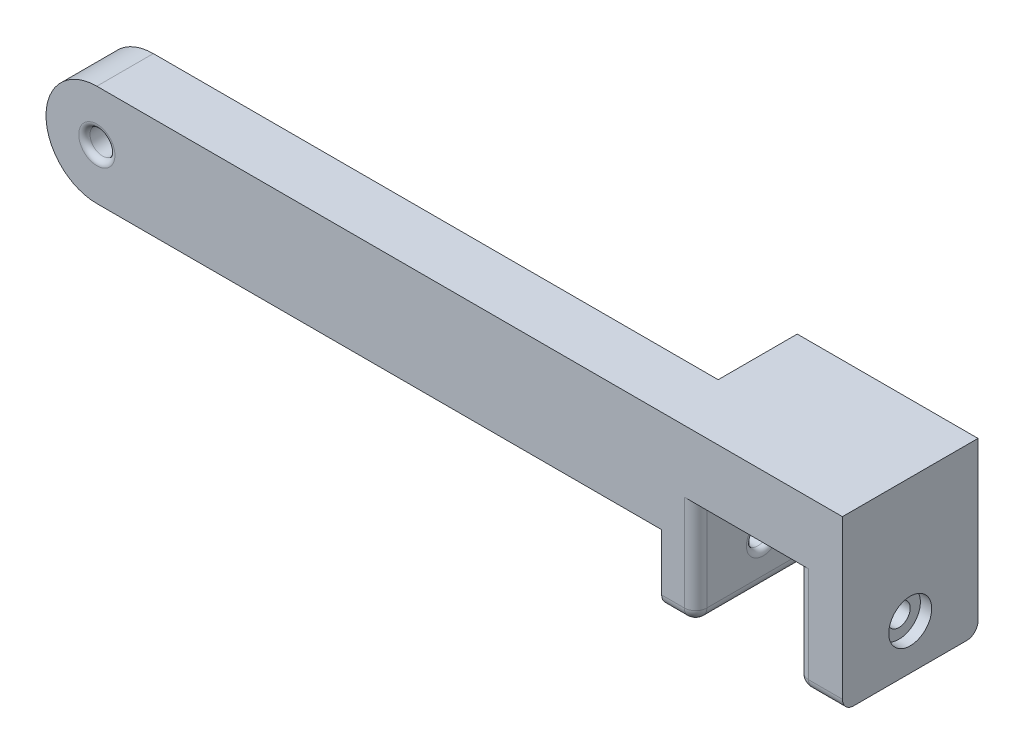
from build123d import *

# Parameters (mm, degrees)
SKETCH1_R           = 1.1
BOSS_EXTRUDE1_DEPTH = 5
SKETCH2_W           = 16
SKETCH2_H           = 12
BOSS_EXTRUDE2_DEPTH = 15
CUT_EXTRUDE1_START  = -5.5
SKETCH3_W           = 9
SKETCH3_H           = 14
CUT_EXTRUDE1_DEPTH  = 9.5
SKETCH4_R           = 1
CUT_EXTRUDE2_DEPTH  = 16
FILLET2_R           = 0.5
SKETCH5_R           = 1.9
CUT_EXTRUDE3_DEPTH  = 1
FILLET3_R           = 1
CUT_EXTRUDE4_START  = -0.5
SKETCH6_R           = 2
CUT_EXTRUDE4_DEPTH  = 5.5
FILLET4_R           = 0.5


with BuildPart() as part:
    # Sketch1 → Boss-Extrude1 (new body)
    with BuildSketch(Plane.XY):
        with BuildLine():
            ThreePointArc((0, 4.5), (-4.5, 0), (0, -4.5))
            Line((0, -4.5), (50, -4.5))
            Line((50, -4.5), (50, 4.5))
            Line((50, 4.5), (0, 4.5))
        make_face()
        Circle(SKETCH1_R, mode=Mode.SUBTRACT)
    extrude(amount=BOSS_EXTRUDE1_DEPTH)

    # Sketch2 → Boss-Extrude2 (add)
    with BuildSketch(Plane(origin=(0, 4.5, 0), x_dir=(1, 0, 0), z_dir=(0, 1, 0))):
        with Locations((58, 1)):
            Rectangle(SKETCH2_W, SKETCH2_H)
    extrude(amount=-BOSS_EXTRUDE2_DEPTH)

    # Sketch3 → Cut-Extrude1 (cut)
    with BuildSketch(Plane(origin=(0, 4.5, 0), x_dir=(1, 0, 0), z_dir=(0, 1, 0)).offset(CUT_EXTRUDE1_START)):
        with Locations((57.5, 2)):
            Rectangle(SKETCH3_W, SKETCH3_H)
    extrude(amount=-CUT_EXTRUDE1_DEPTH, mode=Mode.SUBTRACT)

    # Sketch4 → Cut-Extrude2 (cut)
    with BuildSketch(Plane(origin=(66, 0, 0), x_dir=(0, 0, -1), z_dir=(1, 0, 0))):
        with Locations((1, -6.5)):
            Circle(SKETCH4_R)
    extrude(amount=-CUT_EXTRUDE2_DEPTH, mode=Mode.SUBTRACT)

    # Fillet2
    fillet2_edges = [part.edges().sort_by_distance(p)[0] for p in [
        (53, -6.5, 0),
    ]]
    fillet(fillet2_edges, radius=FILLET2_R)

    # Sketch5 → Cut-Extrude3 (cut)
    with BuildSketch(Plane(origin=(66, 0, 0), x_dir=(0, 0, -1), z_dir=(1, 0, 0))):
        with Locations((1, -6.5)):
            Circle(SKETCH5_R)
    extrude(amount=-CUT_EXTRUDE3_DEPTH, mode=Mode.SUBTRACT)

    # Fillet3
    fillet3_edges = [part.edges().sort_by_distance(p)[0] for p in [
        (53, -10.5, -1),
        (51.5, -10.5, 5),
        (53, -5.75, 5),
        (53, -5.75, -7),
        (51.5, -10.5, -7),
        (64, -10.5, 5),
        (62, -5.75, -7),
        (62, -5.75, 5),
        (64, -10.5, -7),
        (62, -10.5, -1),
    ]]
    fillet(fillet3_edges, radius=FILLET3_R)

    # Sketch6 → Cut-Extrude4 (cut)
    with BuildSketch(Plane.ZY.offset(-50).offset(CUT_EXTRUDE4_START)):
        with Locations((-1, -6.5)):
            Circle(SKETCH6_R)
    extrude(amount=CUT_EXTRUDE4_DEPTH, mode=Mode.SUBTRACT)

    # Fillet4
    fillet4_edges = [part.edges().sort_by_distance(p)[0] for p in [
        (-1.1, 0, 5),
        (-1.1, 0, 0),
    ]]
    fillet(fillet4_edges, radius=FILLET4_R)


solid = part.part
